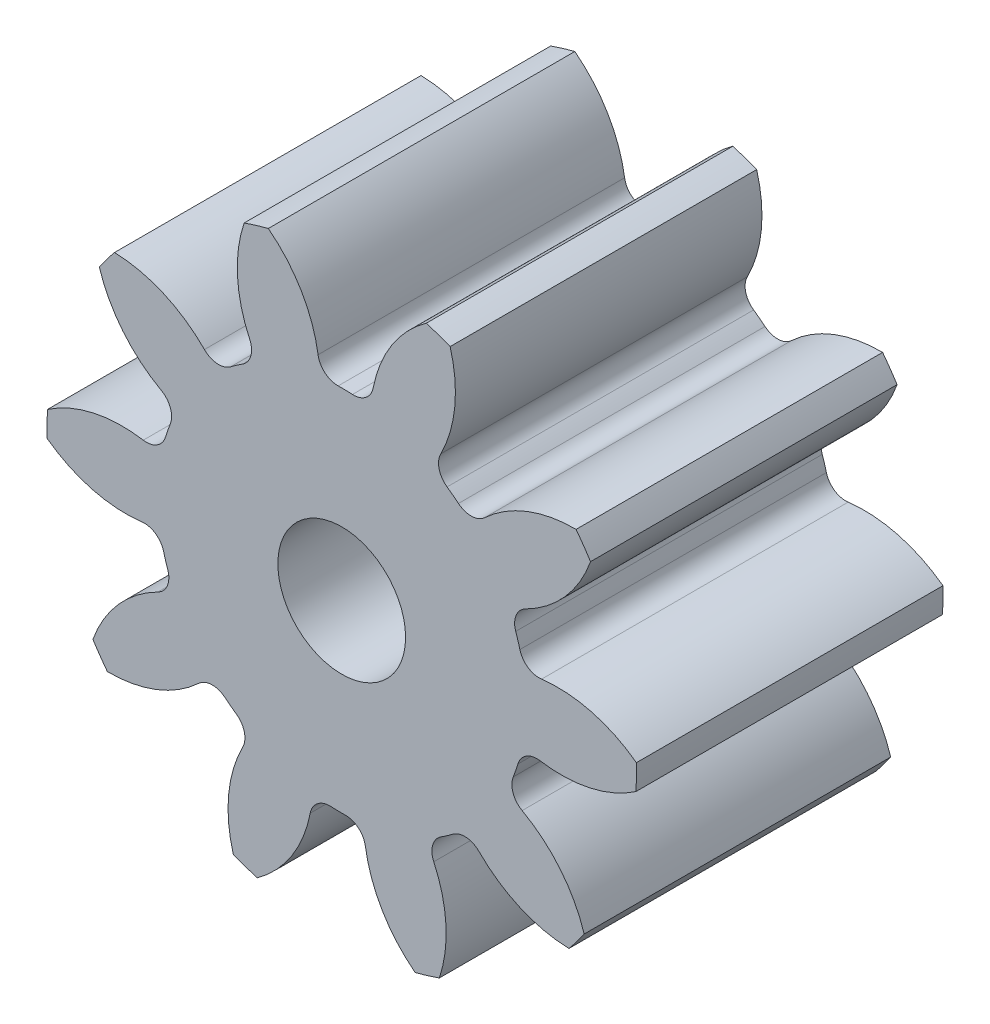
from build123d import *

# Parameters (mm, degrees)
SKETCH3_R         = 5.861538462
GEARBODY_DEPTH    = 6.096
TOOTHCUT_DEPTH    = 11.289629841
CIRPATTERN1_COUNT = 10
BOREDIA_R         = 1.27
BORE_DEPTH        = 12700


with BuildPart() as part:
    # Sketch3 → gearBody (new body)
    with BuildSketch(Plane.XY):
        Circle(SKETCH3_R)
    extrude(amount=GEARBODY_DEPTH)

    # Sketch2 → toothCut (cut, through all)
    with BuildSketch(Plane.XY):
        with BuildLine():
            ThreePointArc((3.410371072, -1.3326694), (3.459525577, -1.199300364), (3.503466664, -1.064124012))
            ThreePointArc((3.503466664, -1.064124012), (3.673182044, -0.842791414), (3.946639633, -0.787906299))
            ThreePointArc((3.946639633, -0.787906299), (5.609569592, -0.511317374), (6.763505117, 0.717613171))
            ThreePointArc((6.763505117, 0.717613171), (6.426274445, -2.22777173), (4.868104082, -4.749898186))
            ThreePointArc((4.868104082, -4.749898186), (4.722411681, -3.07043065), (3.587488494, -1.823920787))
            ThreePointArc((3.587488494, -1.823920787), (3.406677364, -1.61155609), (3.410371072, -1.3326694))
        make_face()
    toothcut = extrude(amount=TOOTHCUT_DEPTH, mode=Mode.SUBTRACT)

    # CirPattern1: toothCut ×10 about axis
    cirpattern1_axis = Axis((0, 0, 6.096), (0, 0, -1))
    for i in range(1, CIRPATTERN1_COUNT):
        add(toothcut.rotate(cirpattern1_axis, i * 360 / CIRPATTERN1_COUNT), mode=Mode.SUBTRACT)

    # boreDia → bore (cut, symmetric)
    with BuildSketch(Plane.XY):
        Circle(BOREDIA_R)
    extrude(amount=BORE_DEPTH, both=True, mode=Mode.SUBTRACT)


solid = part.part
